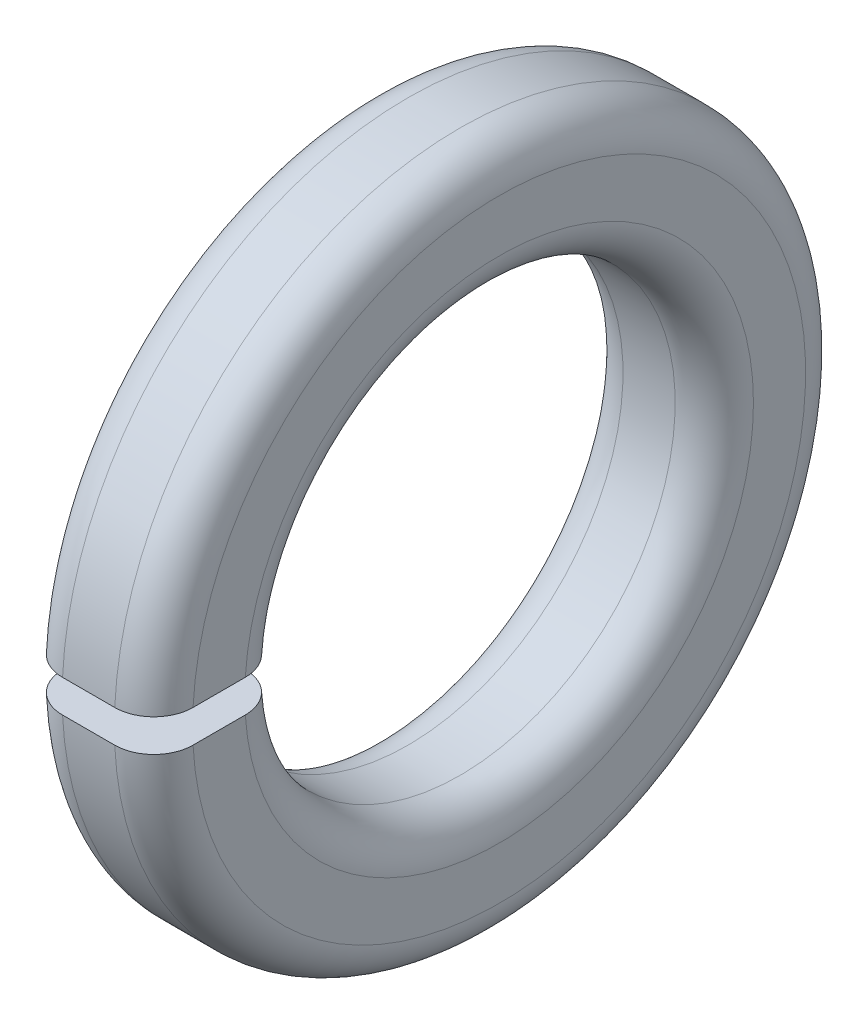
from build123d import *

# Parameters (mm, degrees)
SKETCH2_W = 0.25
SKETCH2_H = 2.703
GAP_DEPTH = 4.878788607


with BuildPart() as part:
    # Sketch1 → Base-Revolve (revolve)
    with BuildSketch(Plane.XY, mode=Mode.PRIVATE) as base_revolve_sk:
        with BuildLine():
            Line((0, 1.95), (0, 2.35))
            ThreePointArc((0, 2.35), (-0.087867966, 2.562132034), (-0.3, 2.65))
            Line((-0.3, 2.65), (-0.7, 2.65))
            ThreePointArc((-0.7, 2.65), (-0.912132034, 2.562132034), (-1, 2.35))
            Line((-1, 2.35), (-1, 1.95))
            ThreePointArc((-1, 1.95), (-0.912132034, 1.737867966), (-0.7, 1.65))
            Line((-0.7, 1.65), (-0.3, 1.65))
            ThreePointArc((-0.3, 1.65), (-0.087867966, 1.737867966), (0, 1.95))
        make_face()
    revolve(base_revolve_sk.sketch.rotate(Axis((-34.925, 0, 0), (1, 0, 0)), 90), axis=Axis((-34.925, 0, 0), (1, 0, 0)))

    # Sketch2 → Gap (cut, through all)
    with BuildSketch(Plane(origin=(0, 0, 0), x_dir=(0, -1, 0), z_dir=(-1, 0, 0))):
        with Locations((0, 1.3515)):
            Rectangle(SKETCH2_W, SKETCH2_H)
    extrude(amount=GAP_DEPTH, mode=Mode.SUBTRACT)


solid = part.part
